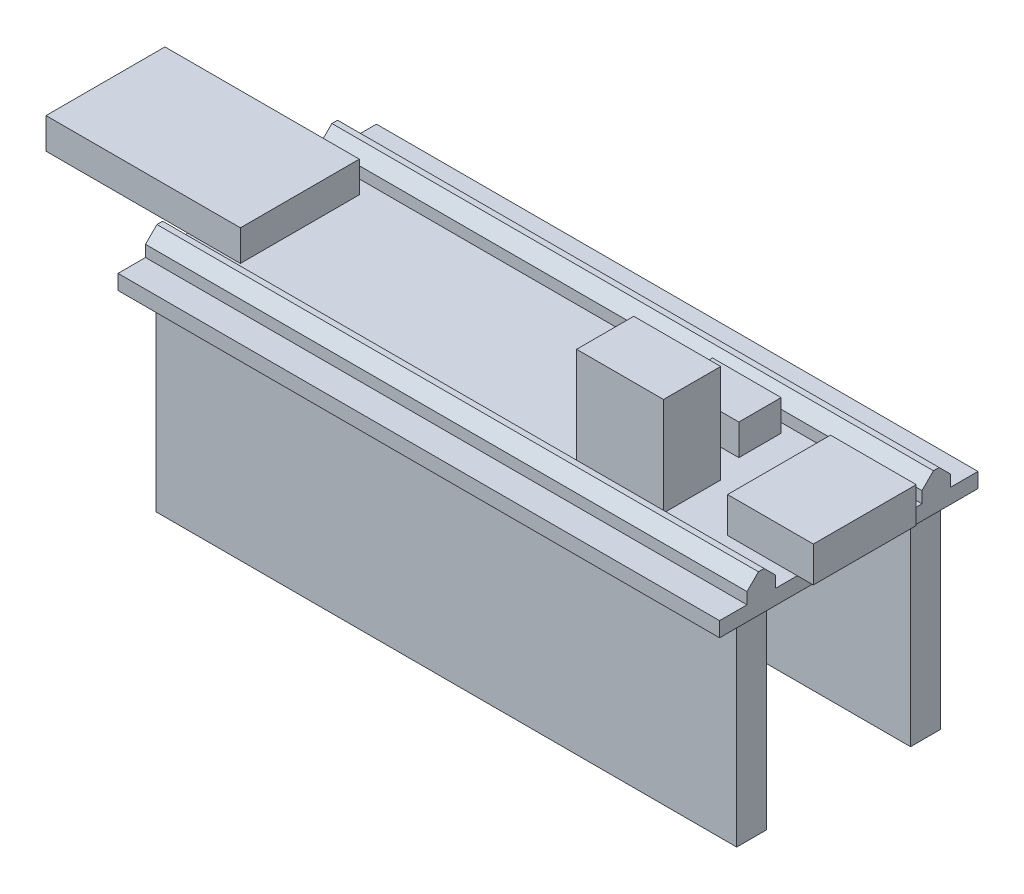
from build123d import *

# Parameters (mm, degrees)
SKETCH_2_W      = 52.6
SKETCH_2_H      = 22.6
EXTRUDE_1_DEPTH = 1.3
SKETCH_3_W      = 52.6
SKETCH_3_H      = 2.5
EXTRUDE_2_DEPTH = 2
CHAMFER_1_SIZE  = 1
SKETCH_4_W      = 6.1
SKETCH_4_H      = 9
SKETCH_4_W_2    = 1.4
EXTRUDE_3_DEPTH = 3.1
SKETCH_5_W      = 12.4
SKETCH_5_H      = 10.4
SKETCH_5_W_2    = 4.6
EXTRUDE_4_DEPTH = 2.7
SKETCH_6_W      = 7.6
SKETCH_6_H      = 5
EXTRUDE_5_DEPTH = 8.6
SKETCH_7_W      = 6
SKETCH_7_H      = 3.7
EXTRUDE_6_DEPTH = 2.7
SKETCH_8_W      = 50.8
SKETCH_8_H      = 2.6
EXTRUDE_8_DEPTH = 17.5


with BuildPart() as part:
    # 草图2 → 凸台-拉伸1 (new body)
    with BuildSketch(Plane(origin=(0, 0, 0), x_dir=(1, 0, 0), z_dir=(0, 1, 0))):
        Rectangle(SKETCH_2_W, SKETCH_2_H)
    extrude(amount=EXTRUDE_1_DEPTH)

    # 草图3 → 凸台-拉伸2 (add)
    with BuildSketch(Plane(origin=(0, 1.3, 0), x_dir=(1, 0, 0), z_dir=(0, 1, 0))):
        with Locations((0, 7.65)):
            Rectangle(SKETCH_3_W, SKETCH_3_H)
        with Locations((0, -7.65)):
            Rectangle(SKETCH_3_W, SKETCH_3_H)
    extrude(amount=EXTRUDE_2_DEPTH)

    # 倒角1
    chamfer_1_edges = [part.edges().sort_by_distance(p)[0] for p in [
        (0, 3.3, -8.9),
        (0, 3.3, -6.4),
        (0, 3.3, 6.4),
        (0, 3.3, 8.9),
    ]]
    chamfer(chamfer_1_edges, length=CHAMFER_1_SIZE)

    # 草图4 → 凸台-拉伸3 (add)
    with BuildSketch(Plane(origin=(0, 1.3, 0), x_dir=(1, 0, 0), z_dir=(0, 1, 0))):
        with Locations((23.25, 0)):
            Rectangle(SKETCH_4_W, SKETCH_4_H)
        with Locations((27, 0)):
            Rectangle(SKETCH_4_W_2, SKETCH_4_H)
    extrude(amount=EXTRUDE_3_DEPTH)

    # 草图5 → 凸台-拉伸4 (add)
    with BuildSketch(Plane(origin=(0, 1.3, 0), x_dir=(1, 0, 0), z_dir=(0, 1, 0))):
        with Locations((-32.5, 0)):
            Rectangle(SKETCH_5_W, SKETCH_5_H)
        with Locations((-24, 0)):
            Rectangle(SKETCH_5_W_2, SKETCH_5_H)
    extrude(amount=EXTRUDE_4_DEPTH)

    # 草图6 → 凸台-拉伸5 (add)
    with BuildSketch(Plane(origin=(0, 1.3, 0), x_dir=(1, 0, 0), z_dir=(0, 1, 0))):
        with Locations((11.9, -3.1)):
            Rectangle(SKETCH_6_W, SKETCH_6_H)
    extrude(amount=EXTRUDE_5_DEPTH)

    # 草图7 → 凸台-拉伸6 (add)
    with BuildSketch(Plane(origin=(0, 1.3, 0), x_dir=(1, 0, 0), z_dir=(0, 1, 0))):
        with Locations((11.8, 3.735961984)):
            Rectangle(SKETCH_7_W, SKETCH_7_H)
    extrude(amount=EXTRUDE_6_DEPTH)

    # 草图8 → 凸台-拉伸8 (add)
    with BuildSketch(Plane.XZ):
        with Locations((0, -7.6)):
            Rectangle(SKETCH_8_W, SKETCH_8_H)
        with Locations((0, 7.6)):
            Rectangle(SKETCH_8_W, SKETCH_8_H)
    extrude(amount=EXTRUDE_8_DEPTH)


solid = part.part
